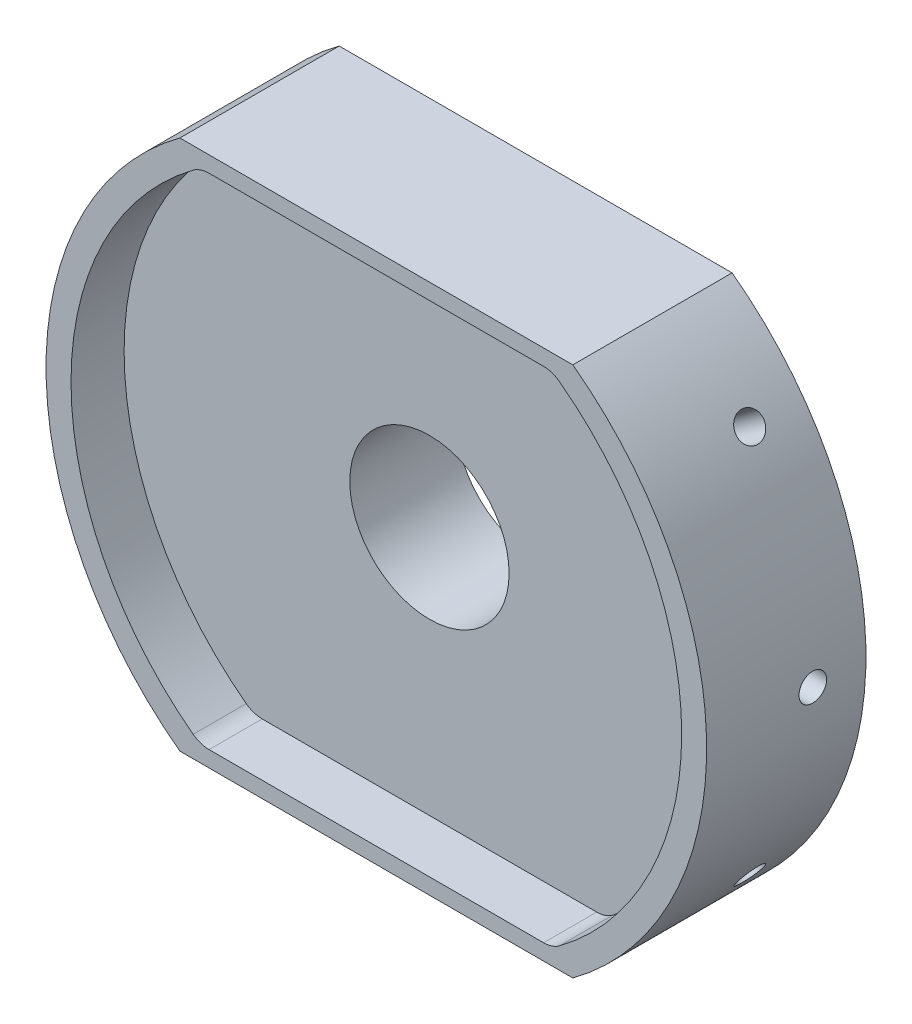
from build123d import *

# Parameters (mm, degrees)
IZIM1_R                     = 62.2
Y_KSEKLIK_EKSTR_ZYON3_DEPTH = 10
Y_KSEKLIK_EKSTR_ZYON4_START = 20
IZIM2_R                     = 62.2
Y_KSEKLIK_EKSTR_ZYON4_DEPTH = 20
IZIM12_R                    = 15
KES_EKSTR_ZYON1_DEPTH       = 93.939119858
DAIRESEL_KAPLAMA1_COUNT     = 10


with BuildPart() as part:
    # Çizim1 → Yükseklik-Ekstrüzyon3 (new body)
    with BuildSketch(Plane.XY):
        Circle(IZIM1_R)
        with BuildLine():
            Line((31.5, 47), (-31.5, 47))
            ThreePointArc((-31.5, 47), (-33.08113883, 46.74341649), (-34.5, 46))
            ThreePointArc((-34.5, 46), (-57.5, 0), (-34.5, -46))
            ThreePointArc((-34.5, -46), (-33.08113883, -46.74341649), (-31.5, -47))
            Line((-31.5, -47), (31.5, -47))
            ThreePointArc((31.5, -47), (33.08113883, -46.74341649), (34.5, -46))
            ThreePointArc((34.5, -46), (57.5, 0), (34.5, 46))
            ThreePointArc((34.5, 46), (33.08113883, 46.74341649), (31.5, 47))
        make_face(mode=Mode.SUBTRACT)
    extrude(amount=Y_KSEKLIK_EKSTR_ZYON3_DEPTH)

    # Çizim2 → Yükseklik-Ekstrüzyon4 (add)
    with BuildSketch(Plane(origin=(0, 0, 0), x_dir=(-1, 0, 0), z_dir=(0, 0, -1)).offset(Y_KSEKLIK_EKSTR_ZYON4_START)):
        Circle(IZIM2_R)
    extrude(amount=-Y_KSEKLIK_EKSTR_ZYON4_DEPTH)

    # Çizim12 → Kes-Ekstrüzyon1 (cut, through all)
    with BuildSketch(Plane.XY.offset(10)):
        Circle(IZIM12_R)
        Polygon((-50.603744818, 50), (50.603744818, 50), (-3.038589064, 77.096458803), align=None)
        Polygon((36.997837775, -50), (-36.997837775, -50), (-1.176281375, -79.482501569), align=None)
    extrude(amount=-KES_EKSTR_ZYON1_DEPTH, mode=Mode.SUBTRACT)

    # Çizim15 → M5x0.8 Helisarmal İçin Dişli Delik1 (revolve, cut)
    with BuildSketch(Plane(origin=(62.2, 0, -10), x_dir=(0, 0, -1), z_dir=(0, 1, 0))):
        Polygon((0, 0), (0, 15.162237609), (2.6, 13.6), (2.6, 0), align=None)
    m5x0_8_helisarmal_in_di_li_delik1 = revolve(axis=Axis((68.55, 0, -10), (-1, 0, 0)), mode=Mode.SUBTRACT)

    # Dairesel Kaplama1: M5x0.8 Helisarmal İçin Dişli Delik1 ×10 about axis, 4 skipped
    dairesel_kaplama1_axis = Axis((0, 0, 10), (0, 0, 1))
    add([m5x0_8_helisarmal_in_di_li_delik1.rotate(dairesel_kaplama1_axis, i * 360 / DAIRESEL_KAPLAMA1_COUNT) for i in range(1, DAIRESEL_KAPLAMA1_COUNT) if i not in (2, 3, 7, 8)], mode=Mode.SUBTRACT)


solid = part.part
